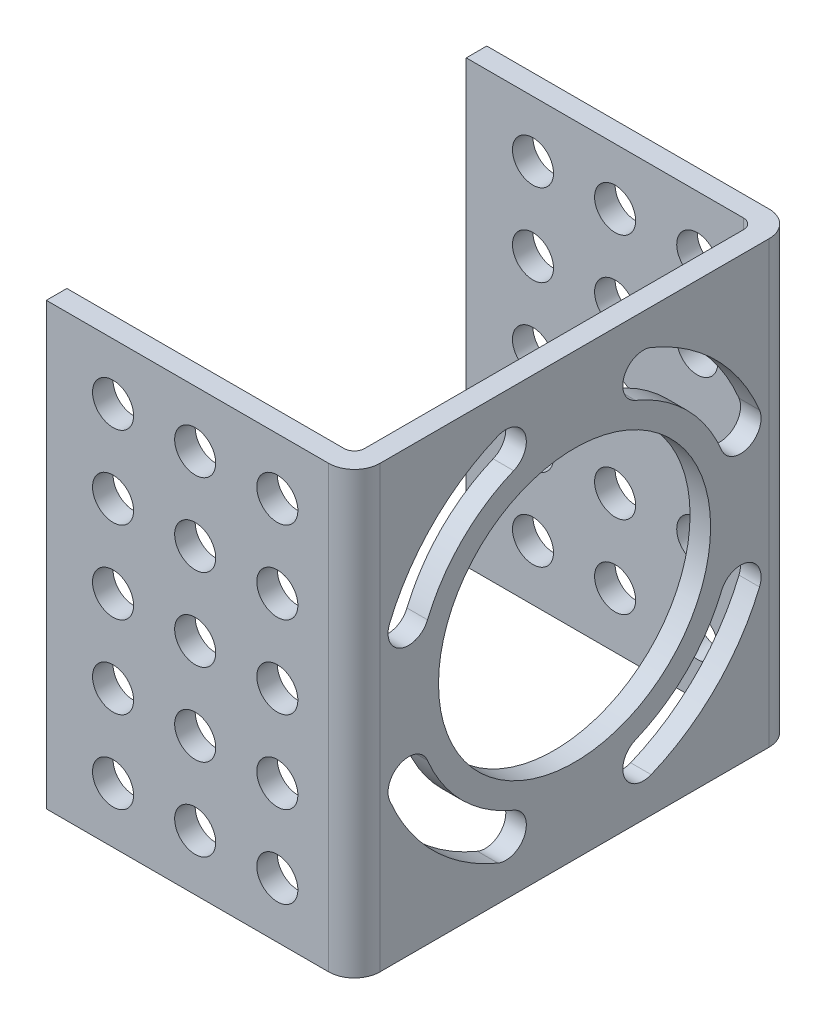
from build123d import *

# Parameters (mm, degrees)
SKETCH1_W           = 42.9
SKETCH1_H           = 42.9
BOSS_EXTRUDE1_DEPTH = 2
SKETCH3_R           = 13.25
CUT_EXTRUDE2_DEPTH  = 61.702718226
SKETCH4_W           = 2
SKETCH4_H           = 42.9
BOSS_EXTRUDE2_DEPTH = 43
SKETCH5_R           = 2
SKETCH5_W           = 15
SKETCH5_H           = 42.9
CUT_EXTRUDE4_DEPTH  = 75.362759497
FILLET1_R           = 2.5
FILLET2_R           = 1


with BuildPart() as part:
    # Sketch1 → Boss-Extrude1 (new body)
    with BuildSketch(Plane(origin=(0, 0, 0), x_dir=(0, 0, -1), z_dir=(1, 0, 0))):
        with Locations((21.45, -21.45)):
            Rectangle(SKETCH1_W, SKETCH1_H)
    extrude(amount=BOSS_EXTRUDE1_DEPTH)

    # Sketch3 → Cut-Extrude2 (cut, through all)
    with BuildSketch(Plane.ZY):
        with Locations((-21.45, -21.45)):
            Circle(SKETCH3_R)
        with BuildLine():
            ThreePointArc((-39.465650884, -13.987673069), (-38.383258684, -16.600798999), (-35.770132754, -15.518406798))
            ThreePointArc((-35.770132754, -15.518406798), (-32.410155108, -10.489844892), (-27.381593202, -7.129867246))
            ThreePointArc((-27.381593202, -7.129867246), (-26.299201001, -4.516741316), (-28.912326931, -3.434349116))
            ThreePointArc((-28.912326931, -3.434349116), (-35.238582233, -7.661417767), (-39.465650884, -13.987673069))
        make_face()
        with BuildLine():
            ThreePointArc((-13.987673069, -3.434349116), (-16.600798999, -4.516741316), (-15.518406798, -7.129867246))
            ThreePointArc((-15.518406798, -7.129867246), (-10.489844892, -10.489844892), (-7.129867246, -15.518406798))
            ThreePointArc((-7.129867246, -15.518406798), (-4.516741316, -16.600798999), (-3.434349116, -13.987673069))
            ThreePointArc((-3.434349116, -13.987673069), (-7.661417767, -7.661417767), (-13.987673069, -3.434349116))
        make_face()
        with BuildLine():
            ThreePointArc((-3.434349116, -28.912326931), (-4.516741316, -26.299201001), (-7.129867246, -27.381593202))
            ThreePointArc((-7.129867246, -27.381593202), (-10.489844892, -32.410155108), (-15.518406798, -35.770132754))
            ThreePointArc((-15.518406798, -35.770132754), (-16.600798999, -38.383258684), (-13.987673069, -39.465650884))
            ThreePointArc((-13.987673069, -39.465650884), (-7.661417767, -35.238582233), (-3.434349116, -28.912326931))
        make_face()
        with BuildLine():
            ThreePointArc((-28.912326931, -39.465650884), (-26.299201001, -38.383258684), (-27.381593202, -35.770132754))
            ThreePointArc((-27.381593202, -35.770132754), (-32.410155108, -32.410155108), (-35.770132754, -27.381593202))
            ThreePointArc((-35.770132754, -27.381593202), (-38.383258684, -26.299201001), (-39.465650884, -28.912326931))
            ThreePointArc((-39.465650884, -28.912326931), (-35.238582233, -35.238582233), (-28.912326931, -39.465650884))
        make_face()
    extrude(amount=-CUT_EXTRUDE2_DEPTH, mode=Mode.SUBTRACT)

    # Sketch4 → Boss-Extrude2 (add)
    with BuildSketch(Plane.ZY):
        with Locations((-41.9, -21.45)):
            Rectangle(SKETCH4_W, SKETCH4_H)
        with Locations((-1, -21.45)):
            Rectangle(SKETCH4_W, SKETCH4_H)
    extrude(amount=BOSS_EXTRUDE2_DEPTH)

    # Sketch5 → Cut-Extrude4 (cut, through all)
    with BuildSketch(Plane(origin=(0, 0, -42.9), x_dir=(-1, 0, 0), z_dir=(0, 0, -1))):
        with Locations(Location((5.5, -5.487209302, 0), (0, 0, 90))):
            Circle(SKETCH5_R)
        with Locations(Location((13.5, -5.487209302, 0), (0, 0, 90))):
            Circle(SKETCH5_R)
        with Locations(Location((21.5, -5.487209302, 0), (0, 0, 90))):
            Circle(SKETCH5_R)
        with Locations(Location((13.5, -13.487209302, 0), (0, 0, 90))):
            Circle(SKETCH5_R)
        with Locations(Location((21.5, -13.487209302, 0), (0, 0, 90))):
            Circle(SKETCH5_R)
        with Locations(Location((13.5, -21.487209302, 0), (0, 0, 90))):
            Circle(SKETCH5_R)
        with Locations(Location((21.5, -21.487209302, 0), (0, 0, 90))):
            Circle(SKETCH5_R)
        with Locations(Location((13.5, -29.487209302, 0), (0, 0, 90))):
            Circle(SKETCH5_R)
        with Locations(Location((21.5, -29.487209302, 0), (0, 0, 90))):
            Circle(SKETCH5_R)
        with Locations(Location((13.5, -37.487209302, 0), (0, 0, 90))):
            Circle(SKETCH5_R)
        with Locations(Location((21.5, -37.487209302, 0), (0, 0, 90))):
            Circle(SKETCH5_R)
        with Locations(Location((5.5, -13.487209302, 0), (0, 0, 90))):
            Circle(SKETCH5_R)
        with Locations(Location((5.5, -21.487209302, 0), (0, 0, 90))):
            Circle(SKETCH5_R)
        with Locations(Location((5.5, -29.487209302, 0), (0, 0, 90))):
            Circle(SKETCH5_R)
        with Locations(Location((5.5, -37.487209302, 0), (0, 0, 90))):
            Circle(SKETCH5_R)
        with Locations((35.5, -21.45)):
            Rectangle(SKETCH5_W, SKETCH5_H)
    extrude(amount=-CUT_EXTRUDE4_DEPTH, mode=Mode.SUBTRACT)

    # Fillet1
    fillet1_edges = [part.edges().sort_by_distance(p)[0] for p in [
        (2, -21.45, -42.9),
        (2, -21.45, 0),
    ]]
    fillet(fillet1_edges, radius=FILLET1_R)

    # Fillet2
    fillet2_edges = [part.edges().sort_by_distance(p)[0] for p in [
        (0, -21.45, -40.9),
        (0, -21.45, -2),
    ]]
    fillet(fillet2_edges, radius=FILLET2_R)


solid = part.part
